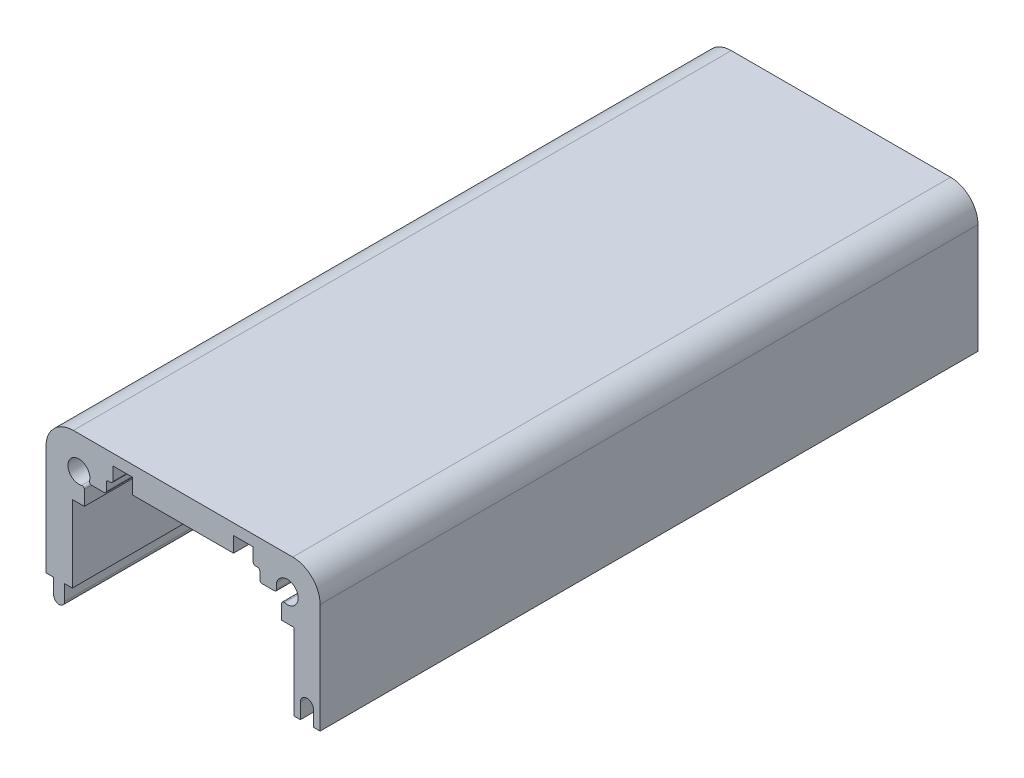
from build123d import *

# Parameters (mm, degrees)
EXTRUDE_1_DEPTH = 60
FILLET_1_R      = 0.2


with BuildPart() as part:
    # 草图1 → 凸台-拉伸1 (new body)
    with BuildSketch(Plane.XY):
        with BuildLine():
            Line((-10, 0), (10, 0))
            ThreePointArc((10, 0), (11.767766953, -0.732233047), (12.5, -2.5))
            Line((12.5, -2.5), (12.5, -12.5))
            Line((12.5, -12.5), (11.9, -12.5))
            Line((11.9, -12.5), (11.9, -11.1))
            ThreePointArc((11.9, -11.1), (11.3, -10.5), (10.7, -11.1))
            Line((10.7, -11.1), (10.7, -12.5))
            Line((10.7, -12.5), (10.1, -12.5))
            Line((10.1, -12.5), (10.1, -5.5))
            Line((10.1, -5.5), (9, -5.5))
            Line((9, -5.5), (9, -3.866025404))
            ThreePointArc((9, -3.866025404), (10.366025404, -2.5), (8.5, -3))
            ThreePointArc((8.5, -3), (8.534074174, -3.258819045), (8.633974596, -3.5))
            Line((8.633974596, -3.5), (7, -3.5))
            Line((7, -3.5), (7, -2.4))
            Line((7, -2.4), (6.4, -2.4))
            Line((6.4, -2.4), (6.4, -1))
            Line((6.4, -1), (4.6, -1))
            Line((4.6, -1), (4.6, -2.4))
            Line((4.6, -2.4), (-4.6, -2.4))
            Line((-4.6, -2.4), (-4.6, -1))
            Line((-4.6, -1), (-6.4, -1))
            Line((-6.4, -1), (-6.4, -2.4))
            Line((-6.4, -2.4), (-7, -2.4))
            Line((-7, -2.4), (-7, -3.5))
            Line((-7, -3.5), (-8.633974596, -3.5))
            ThreePointArc((-8.633974596, -3.5), (-8.534074174, -3.258819045), (-8.5, -3))
            ThreePointArc((-8.5, -3), (-10.366025404, -2.5), (-9, -3.866025404))
            Line((-9, -3.866025404), (-9, -5.5))
            Line((-9, -5.5), (-10.1, -5.5))
            Line((-10.1, -5.5), (-10.1, -12.5))
            Line((-10.1, -12.5), (-10.8, -12.5))
            Line((-10.8, -12.5), (-10.8, -13.9))
            ThreePointArc((-10.8, -13.9), (-11.3, -14.4), (-11.8, -13.9))
            Line((-11.8, -13.9), (-11.8, -12.5))
            Line((-11.8, -12.5), (-12.5, -12.5))
            Line((-12.5, -12.5), (-12.5, -2.5))
            ThreePointArc((-12.5, -2.5), (-11.767766953, -0.732233047), (-10, 0))
        make_face()
    extrude(amount=EXTRUDE_1_DEPTH)

    # 圆角1
    fillet_1_edges = [part.edges().sort_by_distance(p)[0] for p in [
        (9, -3.866025404, 30),
        (8.633974596, -3.5, 30),
        (7, -3.5, 30),
        (7, -2.4, 30),
        (6.4, -2.4, 30),
        (-6.4, -2.4, 30),
        (-7, -2.4, 30),
        (-7, -3.5, 30),
        (-8.633974596, -3.5, 30),
        (-9, -3.866025404, 30),
    ]]
    fillet(fillet_1_edges, radius=FILLET_1_R)


solid = part.part
